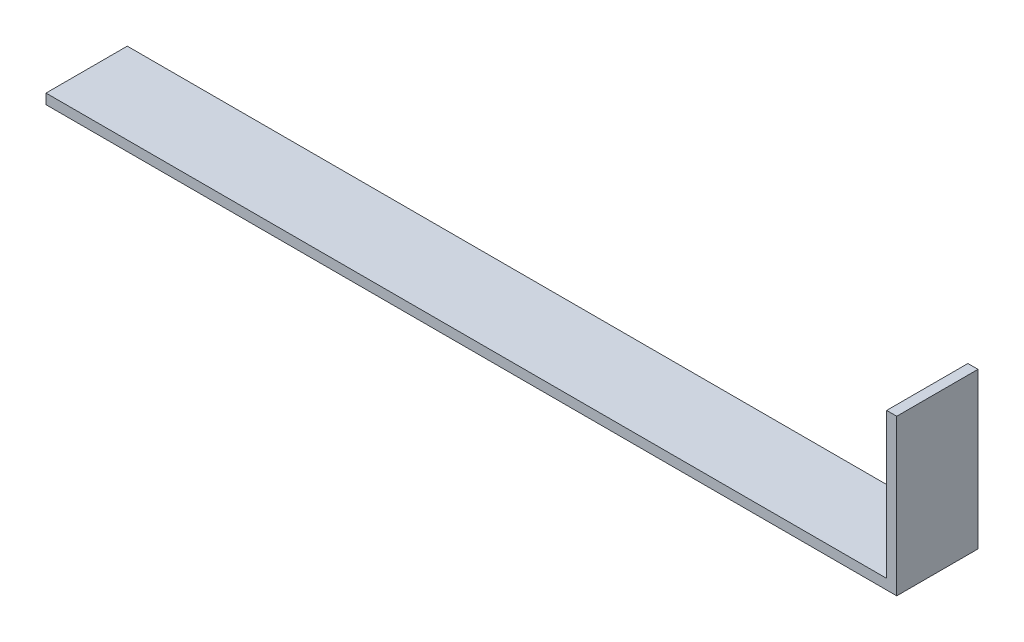
from build123d import *

# Parameters (mm, degrees)
SALIENTE_EXTRUIR1_DEPTH = 50.8
CROQUIS4_W              = 88.392352489
CROQUIS4_H              = 50.8
CORTAR_EXTRUIR2_DEPTH   = 6.31
CROQUIS5_W              = 50.8
CROQUIS5_H              = 6.31
SALIENTE_EXTRUIR2_DEPTH = 322.45


with BuildPart() as part:
    # Croquis1 → Saliente-Extruir1 (new body)
    with BuildSketch(Plane.XY):
        Polygon((0, 0), (202.937647511, 0), (202.937647511, 90.92), (297.64, 90.92), (297.64, 84.61), (209.247647511, 84.61), (209.247647511, -6.31), (0, -6.31), align=None)
    extrude(amount=SALIENTE_EXTRUIR1_DEPTH)

    # Croquis4 → Cortar-Extruir2 (cut)
    with BuildSketch(Plane.XZ.offset(-84.61)):
        with Locations((253.443823756, 25.4)):
            Rectangle(CROQUIS4_W, CROQUIS4_H)
    extrude(amount=-CORTAR_EXTRUIR2_DEPTH, mode=Mode.SUBTRACT)

    # Croquis5 → Saliente-Extruir2 (add)
    with BuildSketch(Plane.ZY):
        with Locations((25.4, -3.155)):
            Rectangle(CROQUIS5_W, CROQUIS5_H)
    extrude(amount=SALIENTE_EXTRUIR2_DEPTH)


solid = part.part
